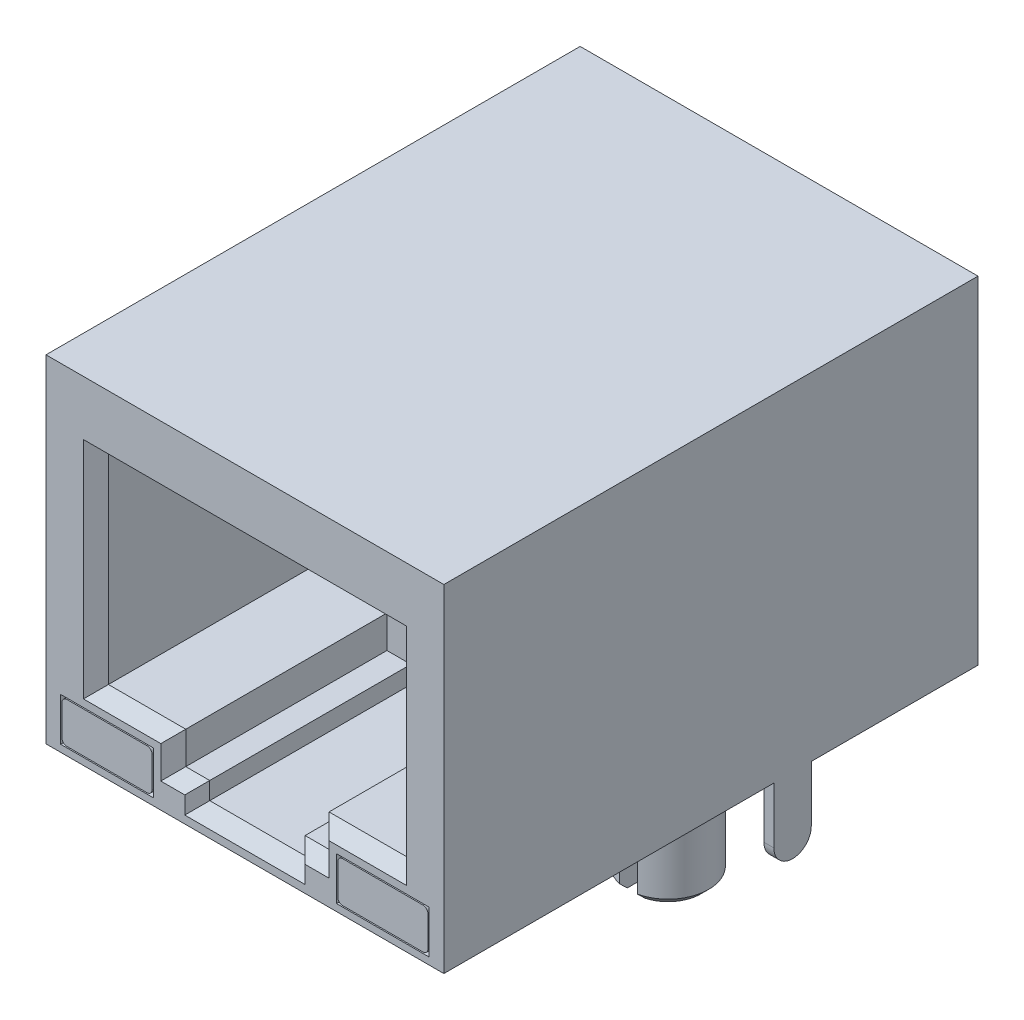
from build123d import *

# Parameters (mm, degrees)
SKETCH2_W            = 15.94
SKETCH2_H            = 21.4
BOSS_EXTRUDE1_DEPTH  = 13.5
CUT_EXTRUDE1_DEPTH   = 8.56
CHAMFER1_SIZE        = 0.5
SKETCH4_W            = 3.71
SKETCH4_H            = 1.73
CUT_EXTRUDE2_DEPTH   = 8
BOSS_EXTRUDE2_DEPTH  = 8
BOSS_EXTRUDE5_DEPTH  = 0.25
LPATTERN1_COUNT      = 8
LPATTERN1_PITCH      = 1
BOSS_EXTRUDE7_START  = 7.97
BOSS_EXTRUDE7_DEPTH  = 0.4
BOSS_EXTRUDE8_START  = -7.57
BOSS_EXTRUDE8_DEPTH  = 0.4
SKETCH9_R            = 1.625
BOSS_EXTRUDE9_DEPTH  = 3
CUT_EXTRUDE3_DEPTH   = 3
CHAMFER2_SIZE        = 0.3
SKETCH11_R           = 0.445
BOSS_EXTRUDE10_DEPTH = 3
CHAMFER3_SIZE        = 0.15


with BuildPart() as part:
    # Sketch2 → Boss-Extrude1 (new body)
    with BuildSketch(Plane(origin=(0, 0, 0), x_dir=(1, 0, 0), z_dir=(0, 1, 0))):
        Rectangle(SKETCH2_W, SKETCH2_H)
    extrude(amount=BOSS_EXTRUDE1_DEPTH)

    # Sketch3 → Cut-Extrude1 (cut)
    with BuildSketch(Plane.XY.offset(10.7)):
        Polygon((-5.97, 10.81), (5.97, 10.81), (5.97, 2.81), (2.87, 2.81), (2.87, 1.51), (1.91, 1.51), (1.91, 0.81), (-1.91, 0.81), (-1.91, 1.51), (-2.87, 1.51), (-2.87, 2.81), (-5.97, 2.81), align=None)
    extrude(amount=-CUT_EXTRUDE1_DEPTH, mode=Mode.SUBTRACT)

    # Chamfer1
    chamfer1_edges = [part.edges().sort_by_distance(p)[0] for p in [
        (-5.97, 6.81, 10.7),
        (-4.42, 2.81, 10.7),
        (-2.87, 2.16, 10.7),
        (-2.39, 1.51, 10.7),
        (-1.91, 1.16, 10.7),
        (0, 0.81, 10.7),
        (1.91, 1.16, 10.7),
        (2.39, 1.51, 10.7),
        (2.87, 2.16, 10.7),
        (4.42, 2.81, 10.7),
        (5.97, 6.81, 10.7),
        (0, 10.81, 10.7),
    ]]
    chamfer(chamfer1_edges, length=CHAMFER1_SIZE)

    # Sketch4 → Cut-Extrude2 (cut)
    with BuildSketch(Plane.XY.offset(10.7)):
        with Locations((-5.525, 1.145)):
            Rectangle(SKETCH4_W, SKETCH4_H)
        with Locations((5.525, 1.145)):
            Rectangle(SKETCH4_W, SKETCH4_H)
    extrude(amount=-CUT_EXTRUDE2_DEPTH, mode=Mode.SUBTRACT)

    # Sketch5 → Boss-Extrude2 (add)
    with BuildSketch(Plane.XY.offset(2.7)):
        with BuildLine():
            Line((-7.13, 1.96), (-3.92, 1.96))
            ThreePointArc((-3.92, 1.96), (-3.778578644, 1.901421356), (-3.72, 1.76))
            Line((-3.72, 1.76), (-3.72, 0.53))
            ThreePointArc((-3.72, 0.53), (-3.778578644, 0.388578644), (-3.92, 0.33))
            Line((-3.92, 0.33), (-7.13, 0.33))
            ThreePointArc((-7.13, 0.33), (-7.271421356, 0.388578644), (-7.33, 0.53))
            Line((-7.33, 0.53), (-7.33, 1.76))
            ThreePointArc((-7.33, 1.76), (-7.271421356, 1.901421356), (-7.13, 1.96))
        make_face()
        with BuildLine():
            Line((3.72, 1.76), (3.72, 0.53))
            ThreePointArc((3.72, 0.53), (3.778578644, 0.388578644), (3.92, 0.33))
            Line((3.92, 0.33), (7.13, 0.33))
            ThreePointArc((7.13, 0.33), (7.271421356, 0.388578644), (7.33, 0.53))
            Line((7.33, 0.53), (7.33, 1.76))
            ThreePointArc((7.33, 1.76), (7.271421356, 1.901421356), (7.13, 1.96))
            Line((7.13, 1.96), (3.92, 1.96))
            ThreePointArc((3.92, 1.96), (3.778578644, 1.901421356), (3.72, 1.76))
        make_face()
    extrude(amount=BOSS_EXTRUDE2_DEPTH)

    # Sketch6 → Boss-Extrude5 (add, symmetric)
    with BuildSketch(Plane.ZY.offset(-3.47)):
        with BuildLine():
            Line((9.157258215, 10.804234071), (9.157258215, 10.623877591))
            ThreePointArc((9.157258215, 10.623877591), (9.087595817, 10.431667837), (8.910960953, 10.328723367))
            Line((8.910960953, 10.328723367), (2.14, 9.096760174))
            Line((2.14, 9.096760174), (2.14, 9.52745757))
            Line((2.14, 9.52745757), (9.157258215, 10.804234071))
        make_face()
    boss_extrude5 = extrude(amount=BOSS_EXTRUDE5_DEPTH, both=True)

    # LPattern1: Boss-Extrude5 ×8
    with Locations(*[(-i * LPATTERN1_PITCH, 0, 0) for i in range(1, LPATTERN1_COUNT)]):
        add(boss_extrude5)

    # Sketch8 → Boss-Extrude7 (add)
    with BuildSketch(Plane(origin=(0, 0, 0), x_dir=(0, 0, -1), z_dir=(1, 0, 0)).offset(BOSS_EXTRUDE7_START)):
        with BuildLine():
            Line((4.02, 0), (4.02, -2.25))
            ThreePointArc((4.02, -2.25), (3.27, -3), (2.52, -2.25))
            Line((2.52, -2.25), (2.52, 0))
            Line((2.52, 0), (4.02, 0))
        make_face()
    extrude(amount=-BOSS_EXTRUDE7_DEPTH)

    # Sketch8<2> → Boss-Extrude8 (add)
    with BuildSketch(Plane(origin=(0, 0, 0), x_dir=(0, 0, -1), z_dir=(1, 0, 0)).offset(BOSS_EXTRUDE8_START)):
        with BuildLine():
            Line((4.02, 0), (4.02, -2.25))
            ThreePointArc((4.02, -2.25), (3.27, -3), (2.52, -2.25))
            Line((2.52, -2.25), (2.52, 0))
            Line((2.52, 0), (4.02, 0))
        make_face()
    extrude(amount=-BOSS_EXTRUDE8_DEPTH)

    # Sketch9 → Boss-Extrude9 (add)
    with BuildSketch(Plane.XZ):
        with Locations(Location((6.030646147, -0.22, 0), (0, 0, 90))):
            Circle(SKETCH9_R)
        with Locations(Location((-6.030646147, -0.22, 0), (0, 0, 90))):
            Circle(SKETCH9_R)
    extrude(amount=BOSS_EXTRUDE9_DEPTH)

    # Sketch10 → Cut-Extrude3 (cut)
    with BuildSketch(Plane.XZ):
        with BuildLine():
            ThreePointArc((-5.673759882, 1.36532558), (-6.030646147, 1.405), (-6.387532412, 1.36532558))
            Line((-6.387532412, 1.36532558), (-6.387532412, -1.80532558))
            ThreePointArc((-6.387532412, -1.80532558), (-6.030646147, -1.845), (-5.673759882, -1.80532558))
            Line((-5.673759882, -1.80532558), (-5.673759882, 1.36532558))
        make_face()
        with BuildLine():
            ThreePointArc((6.387532412, 1.36532558), (6.030646147, 1.405), (5.673759882, 1.36532558))
            Line((5.673759882, 1.36532558), (5.673759882, -1.80532558))
            ThreePointArc((5.673759882, -1.80532558), (6.030646147, -1.845), (6.387532412, -1.80532558))
            Line((6.387532412, -1.80532558), (6.387532412, 1.36532558))
        make_face()
    extrude(amount=CUT_EXTRUDE3_DEPTH, mode=Mode.SUBTRACT)

    # Chamfer2
    chamfer2_edges = [part.edges().sort_by_distance(p)[0] for p in [
        (4.405646147, -3, -0.22),
        (-4.405646147, -3, -0.22),
        (-7.655646147, -3, -0.22),
        (7.655646147, -3, -0.22),
    ]]
    chamfer(chamfer2_edges, length=CHAMFER2_SIZE)

    # Sketch11 → Boss-Extrude10 (add)
    with BuildSketch(Plane.XZ):
        with Locations(Location((-5.013424508, -9.11, 0), (0, 0, 90))):
            Circle(SKETCH11_R)
        with Locations(Location((-2.473424508, -9.11, 0), (0, 0, 90))):
            Circle(SKETCH11_R)
        with Locations(Location((0.066575492, -9.11, 0), (0, 0, 90))):
            Circle(SKETCH11_R)
        with Locations(Location((2.606575492, -9.11, 0), (0, 0, 90))):
            Circle(SKETCH11_R)
        with Locations(Location((-3.719101646, -6.57, 0), (0, 0, 90))):
            Circle(SKETCH11_R)
        with Locations(Location((-1.179101646, -6.57, 0), (0, 0, 90))):
            Circle(SKETCH11_R)
        with Locations(Location((1.360898354, -6.57, 0), (0, 0, 90))):
            Circle(SKETCH11_R)
        with Locations(Location((3.900898354, -6.57, 0), (0, 0, 90))):
            Circle(SKETCH11_R)
    extrude(amount=BOSS_EXTRUDE10_DEPTH)

    # Chamfer3
    chamfer3_edges = [part.edges().sort_by_distance(p)[0] for p in [
        (-5.013424508, -3, -9.555),
        (-2.473424508, -3, -9.555),
        (0.066575492, -3, -9.555),
        (2.606575492, -3, -9.555),
        (-3.719101646, -3, -7.015),
        (-1.179101646, -3, -7.015),
        (1.360898354, -3, -7.015),
        (3.900898354, -3, -7.015),
    ]]
    chamfer(chamfer3_edges, length=CHAMFER3_SIZE)


solid = part.part
